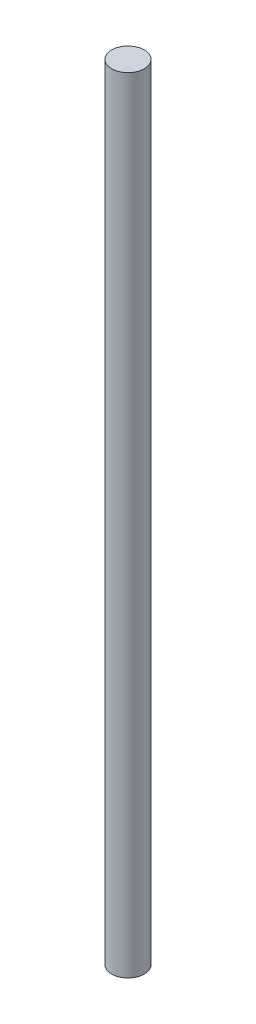
from build123d import *

# Parameters (mm, degrees)
SKETCH1_R           = 1.5
BOSS_EXTRUDE1_DEPTH = 72


with BuildPart() as part:
    # Sketch1 → Boss-Extrude1 (new body)
    with BuildSketch(Plane(origin=(0, 0, 0), x_dir=(1, 0, 0), z_dir=(0, 1, 0))):
        with Locations(Location((0, 0, 0), (0, 0, 270))):
            Circle(SKETCH1_R)
    extrude(amount=BOSS_EXTRUDE1_DEPTH)


solid = part.part
